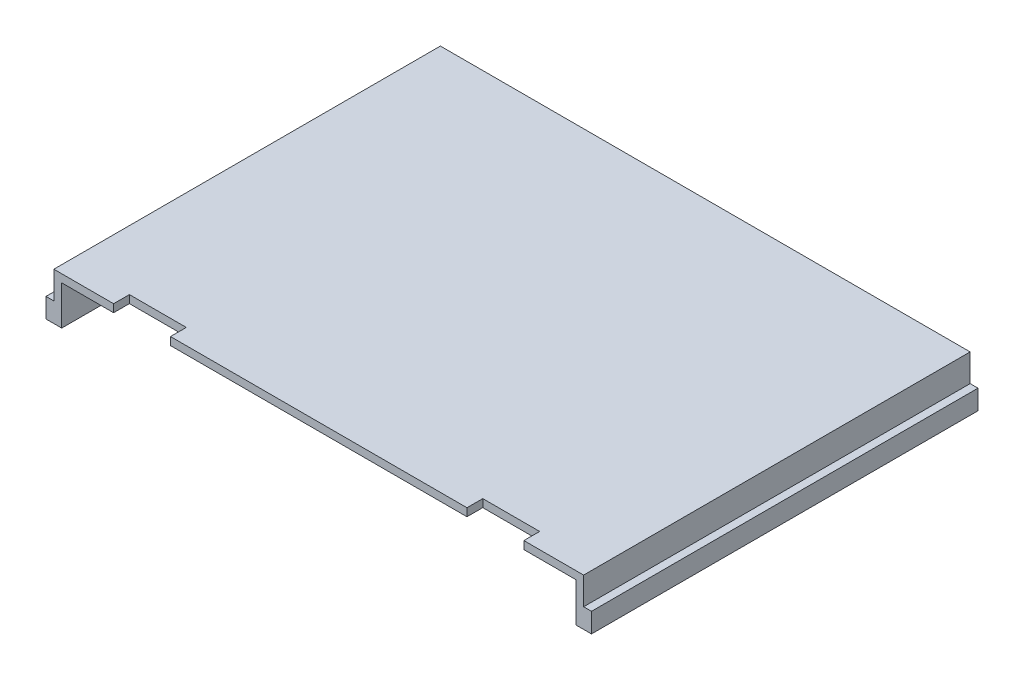
from build123d import *

# Parameters (mm, degrees)
SALIENTE_EXTRUIR1_DEPTH = 197
CROQUIS3_W              = 29
CROQUIS3_H              = 8.05
CORTAR_EXTRUIR1_DEPTH   = 299.793079874


with BuildPart() as part:
    # Croquis1 → Saliente-Extruir1 (new body)
    with BuildSketch(Plane.XY):
        Polygon((219.365853659, 10.012195122), (-50.634146341, 10.012195122), (-50.634146341, -3.987804878), (-54.634146341, -3.987804878), (-54.634146341, -13.987804878), (-49.344908275, -13.987804878), (-46.634146341, -13.987804878), (-46.634146341, -3.987804878), (-46.634146341, 6.012195122), (215.365853659, 6.012195122), (215.365853659, -3.987804878), (215.365853659, -13.987804878), (219.1357706, -13.987804878), (223.365853659, -13.987804878), (223.365853659, -3.987804878), (219.365853659, -3.987804878), align=None)
    extrude(amount=SALIENTE_EXTRUIR1_DEPTH)

    # Croquis3 → Cortar-Extruir1 (cut, through all)
    with BuildSketch(Plane(origin=(0, 10.012195122, 0), x_dir=(1, 0, 0), z_dir=(0, 1, 0))):
        with Locations((-5.684146341, -192.975)):
            Rectangle(CROQUIS3_W, CROQUIS3_H)
        with Locations((174.415853659, -192.975)):
            Rectangle(CROQUIS3_W, CROQUIS3_H)
    extrude(amount=-CORTAR_EXTRUIR1_DEPTH, mode=Mode.SUBTRACT)


solid = part.part
